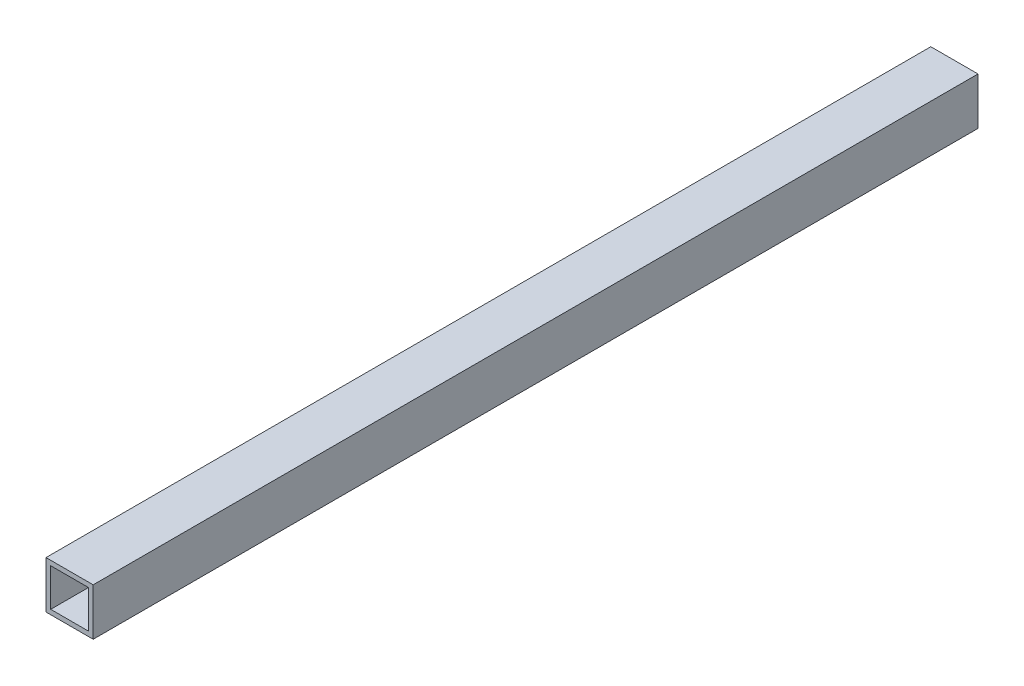
from build123d import *

# Parameters (mm, degrees)
SKETCH_1_W      = 40
SKETCH_1_H      = 40
SKETCH_1_W_2    = 32
SKETCH_1_H_2    = 32
EXTRUDE_1_DEPTH = 750


with BuildPart() as part:
    # Эскиз1 → Вытянуть-Тонкостенный1 (new body)
    with BuildSketch(Plane.XY):
        with Locations((20, 20)):
            Rectangle(SKETCH_1_W, SKETCH_1_H)
        with Locations((20, 20)):
            Rectangle(SKETCH_1_W_2, SKETCH_1_H_2, mode=Mode.SUBTRACT)
    extrude(amount=EXTRUDE_1_DEPTH)


solid = part.part
